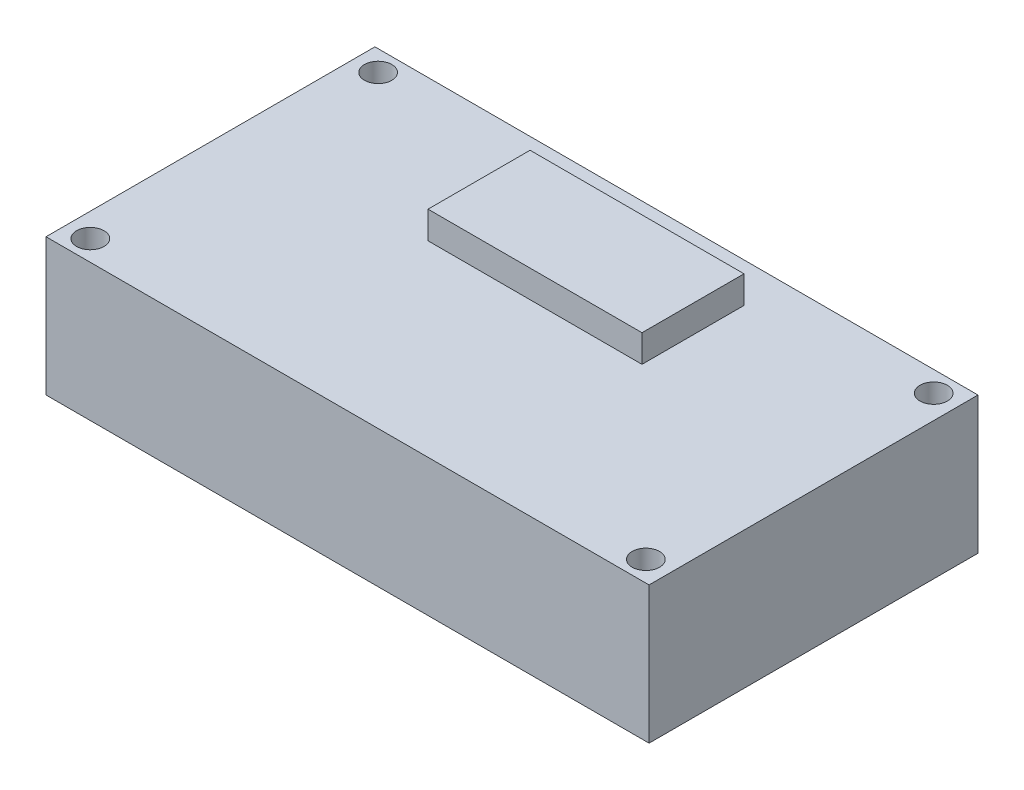
from build123d import *

# Parameters (mm, degrees)
SKETCH1_W           = 66
SKETCH1_H           = 36
BOSS_EXTRUDE1_DEPTH = 15
SKETCH2_R           = 1.5
CUT_EXTRUDE1_DEPTH  = 15
SKETCH3_W           = 23.416915526
SKETCH3_H           = 11.166785339
BOSS_EXTRUDE2_DEPTH = 3


with BuildPart() as part:
    # Sketch1 → Boss-Extrude1 (new body)
    with BuildSketch(Plane(origin=(0, 0, 0), x_dir=(1, 0, 0), z_dir=(0, 1, 0))):
        Rectangle(SKETCH1_W, SKETCH1_H)
    extrude(amount=BOSS_EXTRUDE1_DEPTH)

    # Sketch2 → Cut-Extrude1 (cut)
    with BuildSketch(Plane(origin=(0, 15, 0), x_dir=(1, 0, 0), z_dir=(0, 1, 0))):
        with Locations(Location((-30.4, 15.75, 0), (0, 0, 270))):
            Circle(SKETCH2_R)
        with Locations(Location((-30.4, -15.75, 0), (0, 0, 270))):
            Circle(SKETCH2_R)
        with Locations(Location((30.4, 15.75, 0), (0, 0, 270))):
            Circle(SKETCH2_R)
        with Locations(Location((30.4, -15.75, 0), (0, 0, 270))):
            Circle(SKETCH2_R)
    extrude(amount=-CUT_EXTRUDE1_DEPTH, mode=Mode.SUBTRACT)

    # Sketch3 → Boss-Extrude2 (add)
    with BuildSketch(Plane(origin=(0, 15, 0), x_dir=(1, 0, 0), z_dir=(0, 1, 0))):
        with Locations((0, 8.102465218)):
            Rectangle(SKETCH3_W, SKETCH3_H)
    extrude(amount=BOSS_EXTRUDE2_DEPTH)


solid = part.part
